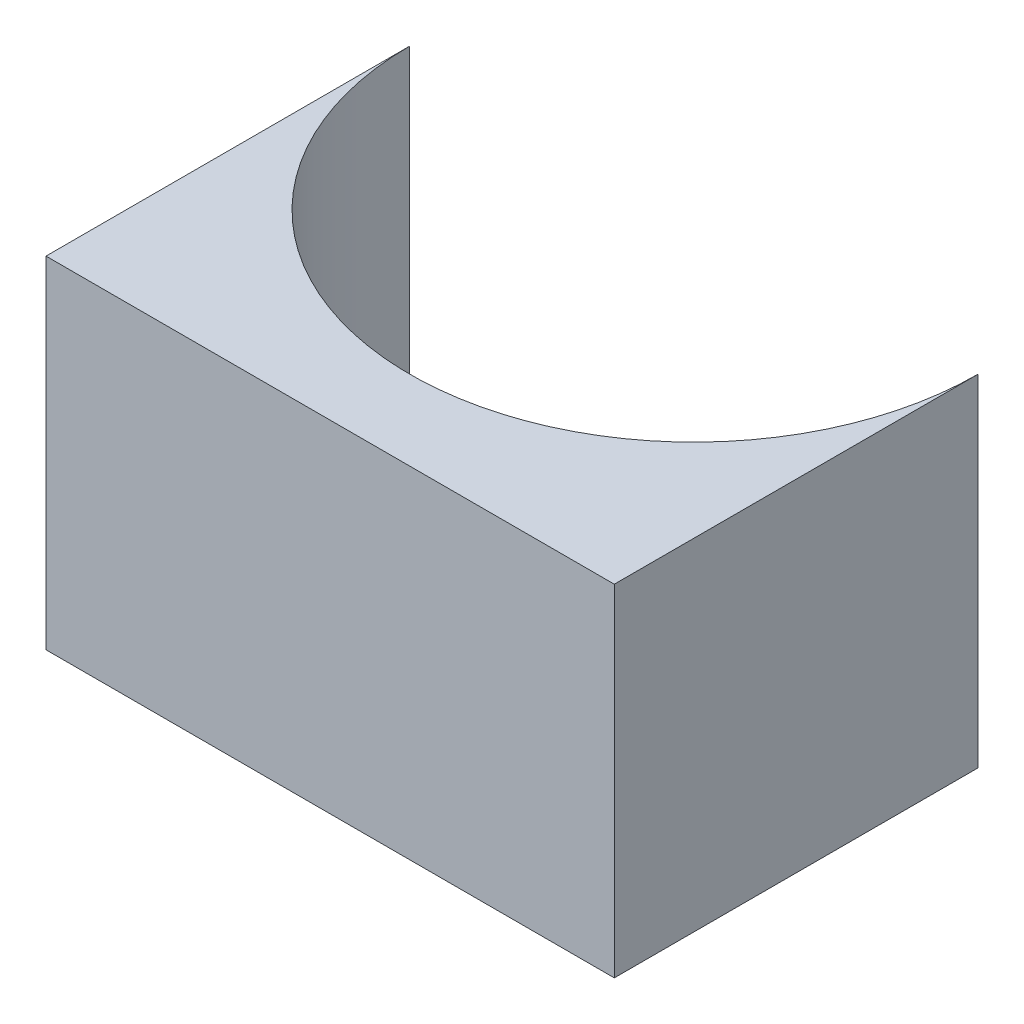
from build123d import *

# Parameters (mm, degrees)
BOSS_EXTRUDE1_DEPTH = 30


with BuildPart() as part:
    # Sketch1 → Boss-Extrude1 (new body)
    with BuildSketch(Plane(origin=(0, 0, 0), x_dir=(1, 0, 0), z_dir=(0, 1, 0))):
        with BuildLine():
            Line((-37.5, -16), (12.5, -16))
            Line((12.5, -16), (12.5, 16))
            ThreePointArc((12.5, 16), (-12.5, -9), (-37.5, 16))
            Line((-37.5, 16), (-37.5, -16))
        make_face()
    extrude(amount=BOSS_EXTRUDE1_DEPTH)


solid = part.part
